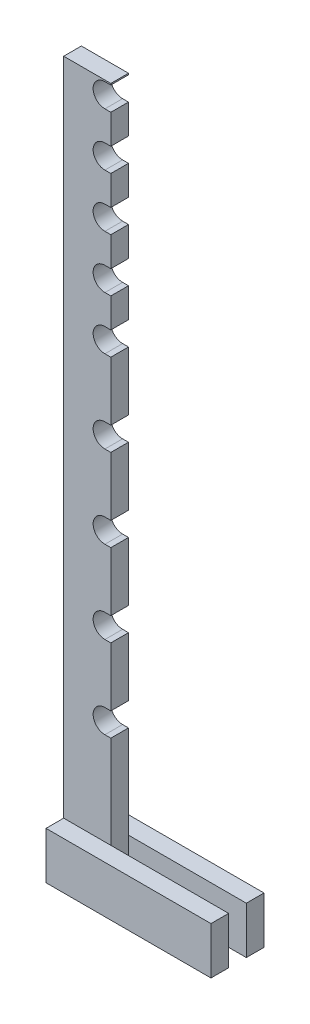
from build123d import *

# Parameters (mm, degrees)
SKETCH1_W           = 50.8
SKETCH1_H           = 762
BOSS_EXTRUDE1_DEPTH = 9.525
SKETCH3_W           = 177.8
SKETCH3_H           = 50.8
BOSS_EXTRUDE2_DEPTH = 19.05
CUT_EXTRUDE1_DEPTH  = 784.395462075
LPATTERN6_COUNT     = 5
LPATTERN6_PITCH     = 88.9
CUT_EXTRUDE3_DEPTH  = 784.395462075


with BuildPart() as part:
    # Sketch1 → Boss-Extrude1 (new, symmetric)
    with BuildSketch(Plane.XY):
        with Locations((25.4, 381)):
            Rectangle(SKETCH1_W, SKETCH1_H)
    extrude(amount=BOSS_EXTRUDE1_DEPTH, both=True)

    # Sketch2 → Cut-Extrude1 (cut, through all)
    with BuildSketch(Plane.XY.offset(9.525)):
        with BuildLine():
            Line((44.45, 176.276), (50.8, 176.276))
            Line((50.8, 176.276), (50.8, 150.876))
            Line((50.8, 150.876), (44.45, 150.876))
            ThreePointArc((44.45, 150.876), (31.75, 163.576), (44.45, 176.276))
        make_face()
    cut_extrude1 = extrude(amount=-CUT_EXTRUDE1_DEPTH, mode=Mode.SUBTRACT)

    # LPattern6: Cut-Extrude1 ×5
    with Locations(*[(0, i * LPATTERN6_PITCH, 0) for i in range(1, LPATTERN6_COUNT)]):
        add(cut_extrude1, mode=Mode.SUBTRACT)

    # Sketch5 → Cut-Extrude3 (cut, through all)
    with BuildSketch(Plane(origin=(0, 0, -9.525), x_dir=(-1, 0, 0), z_dir=(0, 0, -1))):
        with BuildLine():
            Line((-44.45, 531.876), (-50.8, 531.876))
            Line((-50.8, 531.876), (-50.8, 506.476))
            Line((-50.8, 506.476), (-44.45, 506.476))
            ThreePointArc((-44.45, 506.476), (-31.75, 519.176), (-44.45, 531.876))
        make_face()
        with BuildLine():
            Line((-50.8, 589.026), (-50.8, 563.626))
            Line((-50.8, 563.626), (-44.45, 563.626))
            ThreePointArc((-44.45, 563.626), (-31.75, 576.326), (-44.45, 589.026))
            Line((-44.45, 589.026), (-50.8, 589.026))
        make_face()
        with BuildLine():
            Line((-50.8, 646.176), (-50.8, 620.776))
            Line((-50.8, 620.776), (-44.45, 620.776))
            ThreePointArc((-44.45, 620.776), (-31.75, 633.476), (-44.45, 646.176))
            Line((-44.45, 646.176), (-50.8, 646.176))
        make_face()
        with BuildLine():
            Line((-50.8, 703.326), (-50.8, 677.926))
            Line((-50.8, 677.926), (-44.45, 677.926))
            ThreePointArc((-44.45, 677.926), (-31.75, 690.626), (-44.45, 703.326))
            Line((-44.45, 703.326), (-50.8, 703.326))
        make_face()
        with BuildLine():
            Line((-50.8, 760.476), (-50.8, 735.076))
            Line((-50.8, 735.076), (-44.45, 735.076))
            ThreePointArc((-44.45, 735.076), (-31.75, 747.776), (-44.45, 760.476))
            Line((-44.45, 760.476), (-50.8, 760.476))
        make_face()
    extrude(amount=-CUT_EXTRUDE3_DEPTH, mode=Mode.SUBTRACT)


with BuildPart() as body_2:
    # Sketch3 → Boss-Extrude2 (new body)
    with BuildSketch(Plane.XY.offset(9.525)):
        with Locations((88.9, 25.4)):
            Rectangle(SKETCH3_W, SKETCH3_H)
    extrude(amount=BOSS_EXTRUDE2_DEPTH)


with BuildPart() as body_3:
    # Mirror1: mirrored copy
    add(body_2.part.mirror(Plane.XY))


solid = Compound([part.part, body_2.part, body_3.part])
